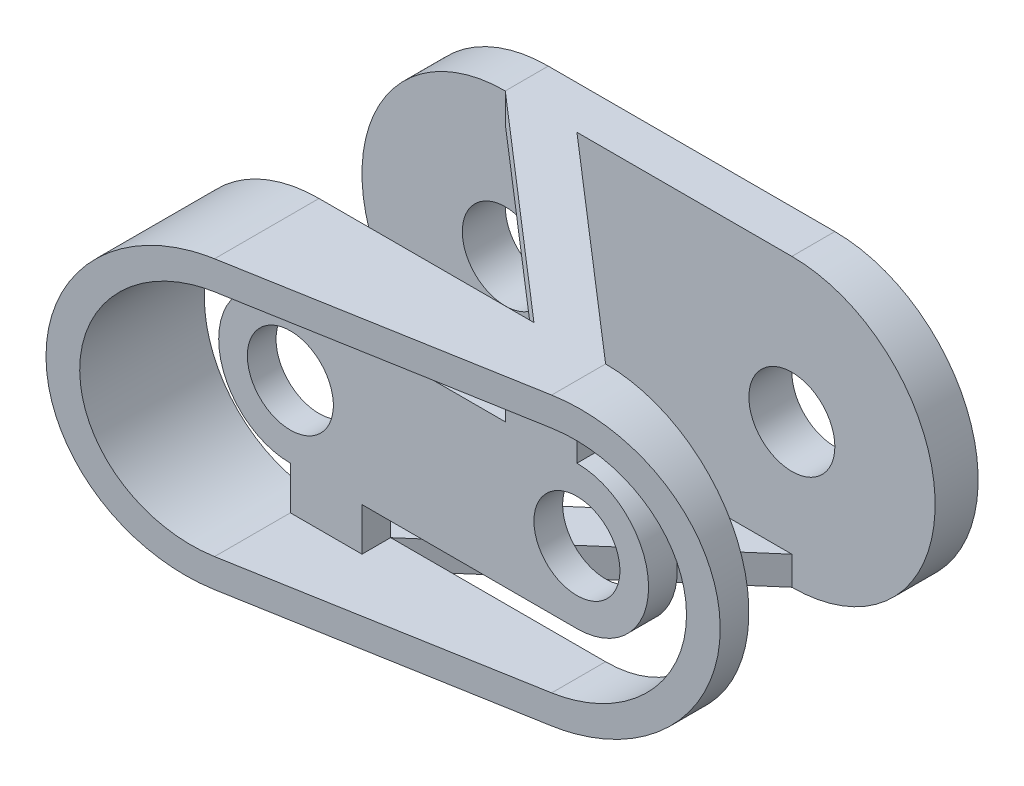
from build123d import *

# Parameters (mm, degrees)
SKETCH1_R               = 15
BOSS_EXTRUDE1_DEPTH     = 15
BOSS_EXTRUDE2_START     = 80
BOSS_EXTRUDE2_DEPTH     = 70
CUT_EXTRUDE1_DEPTH      = 188.082869339
CUT_EXTRUDE1_DEPTH_BACK = 188.082869339
SKETCH4_R               = 15
CUT_EXTRUDE2_DEPTH      = 70
CUT_EXTRUDE4_DEPTH      = 70
SKETCH4_4_R             = 15
BOSS_EXTRUDE4_DEPTH     = 10
BOSS_EXTRUDE5_DEPTH     = 10
BOSS_EXTRUDE6_DEPTH     = 10


with BuildPart() as part:
    # Sketch1 → Boss-Extrude1 (new body)
    with BuildSketch(Plane.XY):
        with BuildLine():
            Line((50, -50), (-50, -50))
            ThreePointArc((-50, -50), (-100, 0), (-50, 50))
            Line((-50, 50), (50, 50))
            ThreePointArc((50, 50), (100, 0), (50, -50))
        make_face()
        with Locations((-50, 0)):
            Circle(SKETCH1_R, mode=Mode.SUBTRACT)
        with Locations((50, 0)):
            Circle(SKETCH1_R, mode=Mode.SUBTRACT)
    extrude(amount=BOSS_EXTRUDE1_DEPTH)



with BuildPart() as body_2:
    # Sketch1<3> → Boss-Extrude2 (new body)
    with BuildSketch(Plane.XY.offset(BOSS_EXTRUDE2_START)):
        with BuildLine():
            Line((50, -50), (-50, -50))
            ThreePointArc((-50, -50), (-100, 0), (-50, 50))
            Line((-50, 50), (50, 50))
            ThreePointArc((50, 50), (100, 0), (50, -50))
        make_face()
    extrude(amount=BOSS_EXTRUDE2_DEPTH)

    # Sketch3 → Cut-Extrude1 (cut, two sides: drawn at the far end of the back side and taken through both)
    with BuildSketch(Plane(origin=(0, 0, 0), x_dir=(1, 0, 0), z_dir=(0, 1, 0)).offset(-CUT_EXTRUDE1_DEPTH_BACK)):
        Polygon((100, -90), (-100, -125.265396142), (-100, -150), (100, -150), align=None)
    extrude(amount=CUT_EXTRUDE1_DEPTH + CUT_EXTRUDE1_DEPTH_BACK, mode=Mode.SUBTRACT)

    # Sketch4 → Cut-Extrude2 (cut)
    with BuildSketch(Plane(origin=(0, 0, 80), x_dir=(-1, 0, 0), z_dir=(0, 0, -1))):
        with Locations((-50, 0)):
            Circle(SKETCH4_R)
        with Locations((50, 0)):
            Circle(SKETCH4_R)
    extrude(amount=-CUT_EXTRUDE2_DEPTH, mode=Mode.SUBTRACT)

    # Sketch6 → Cut-Extrude4 (cut)
    with BuildSketch(Plane(origin=(0, 0, 80), x_dir=(-1, 0, 0), z_dir=(0, 0, -1))):
        with BuildLine():
            Line((50, -40), (-50, -40))
            ThreePointArc((-50, -40), (-90, 0), (-50, 40))
            Line((-50, 40), (50, 40))
            ThreePointArc((50, 40), (90, 0), (50, -40))
        make_face()
    extrude(amount=-CUT_EXTRUDE4_DEPTH, mode=Mode.SUBTRACT)

    # Sketch4<4> → Boss-Extrude4 (add)
    with BuildSketch(Plane(origin=(0, 0, 80), x_dir=(-1, 0, 0), z_dir=(0, 0, -1))):
        with BuildLine():
            Line((-50, -25), (25, -25))
            Line((25, -25), (25, -40))
            Line((25, -40), (50, -40))
            Line((50, -40), (50, -25))
            ThreePointArc((50, -25), (75, 0), (50, 25))
            Line((50, 25), (-25, 25))
            Line((-25, 25), (-25, 40))
            Line((-25, 40), (-50, 40))
            Line((-50, 40), (-50, 25))
            ThreePointArc((-50, 25), (-75, 0), (-50, -25))
        make_face()
        with Locations((-50, 0)):
            Circle(SKETCH4_4_R, mode=Mode.SUBTRACT)
        with Locations((50, 0)):
            Circle(SKETCH4_4_R, mode=Mode.SUBTRACT)
    extrude(amount=-BOSS_EXTRUDE4_DEPTH)


with BuildPart() as part_1:
    add(part.part)

    add(body_2.part)  # Boss-Extrude5 merges body 2
    # Sketch8 → Boss-Extrude5 (add)
    with BuildSketch(Plane.XZ.offset(50)):
        Polygon((-50, 80), (-25, 80), (50, 15), (25, 15), align=None)
    extrude(amount=-BOSS_EXTRUDE5_DEPTH)

    # Sketch9 → Boss-Extrude6 (add)
    with BuildSketch(Plane(origin=(0, 50, 0), x_dir=(1, 0, 0), z_dir=(0, 1, 0))):
        Polygon((50, -80), (25, -80), (-50, -15), (-25, -15), align=None)
    extrude(amount=-BOSS_EXTRUDE6_DEPTH)


solid = part_1.part
